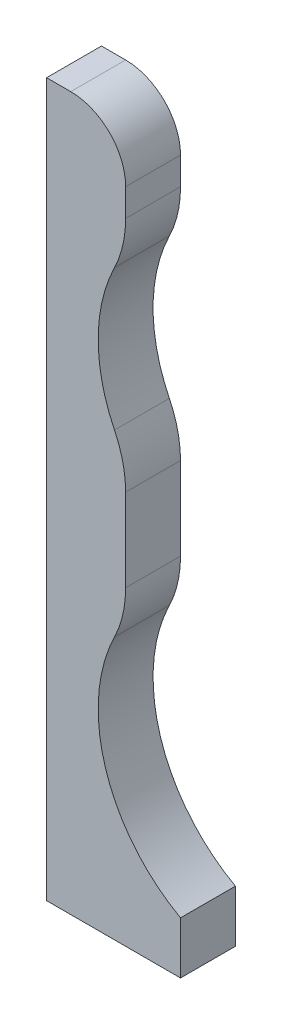
from build123d import *

# Parameters (mm, degrees)
BOSS_EXTRUDE1_DEPTH = 3.175


with BuildPart() as part:
    # Sketch1 → Boss-Extrude1 (new body)
    with BuildSketch(Plane.XY):
        with BuildLine():
            Line((3133.306563013, 2687.827804167), (3133.306563013, 2646.599549756))
            Line((3133.306563013, 2646.599549756), (3141.053563013, 2646.599549756))
            Line((3141.053563013, 2646.599549756), (3141.053563013, 2649.613480065))
            ThreePointArc((3141.053563013, 2649.613480065), (3136.716859864, 2654.928735867), (3137.232449867, 2661.769284485))
            ThreePointArc((3137.232449867, 2661.769284485), (3137.714926303, 2663.127740483), (3137.878563013, 2664.560014633))
            Line((3137.878563013, 2664.560014633), (3137.878563013, 2669.350266686))
            ThreePointArc((3137.878563013, 2669.350266686), (3137.714926303, 2670.782540835), (3137.232449867, 2672.140996834))
            ThreePointArc((3137.232449867, 2672.140996834), (3136.291063013, 2676.207090659), (3137.232449867, 2680.273184485))
            ThreePointArc((3137.232449867, 2680.273184485), (3137.714926303, 2681.631640483), (3137.878563013, 2683.063914633))
            Line((3137.878563013, 2683.063914633), (3137.878563013, 2684.652804167))
            ThreePointArc((3137.878563013, 2684.652804167), (3136.948627043, 2686.897868197), (3134.703563013, 2687.827804167))
            Line((3134.703563013, 2687.827804167), (3133.306563013, 2687.827804167))
        make_face()
    extrude(amount=BOSS_EXTRUDE1_DEPTH)


solid = part.part
